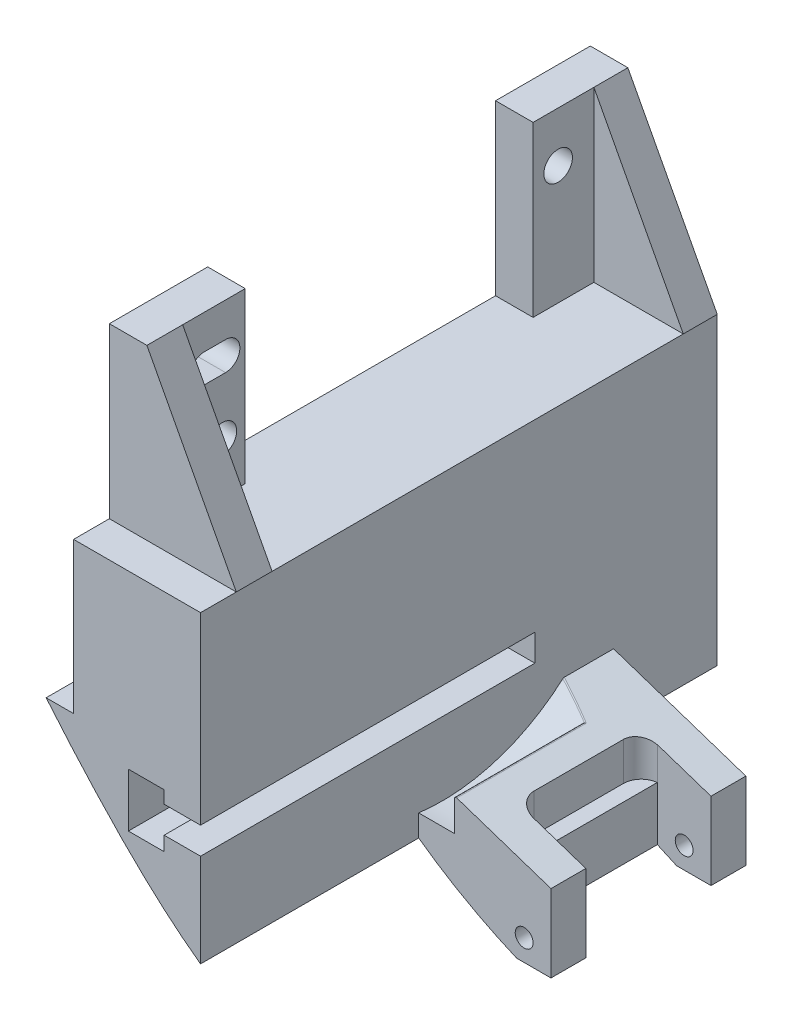
from build123d import *

# Parameters (mm, degrees)
BOSS_EXTRUDE1_DEPTH = 73.406
SKETCH2_W           = 5.08
SKETCH2_H           = 23.996252619
SKETCH2_W_2         = 40.894
CUT_EXTRUDE1_DEPTH  = 112.686247001
SKETCH3_W           = 58.42
SKETCH3_H           = 23.996252619
CUT_EXTRUDE2_DEPTH  = 12.7
SKETCH4_R           = 2.032
CUT_EXTRUDE3_DEPTH  = 114.950293405
SKETCH5_W           = 30.988
SKETCH5_H           = 17.263986836
SKETCH5_W_2         = 14.732
CUT_EXTRUDE4_DEPTH  = 18.796
CUT_EXTRUDE5_DEPTH  = 47.498
SKETCH7_W           = 7.62
SKETCH7_H           = 17.78
CUT_EXTRUDE6_DEPTH  = 22.098
CUT_EXTRUDE7_DEPTH  = 42.164
SKETCH9_R           = 1.27
CUT_EXTRUDE8_DEPTH  = 777.033475109
CUT_EXTRUDE9_DEPTH  = 5.08
FILLET1_R           = 0.254


with BuildPart() as part:
    # Sketch1 → Boss-Extrude1 (new body)
    with BuildSketch(Plane.XY):
        with BuildLine():
            Line((-748.665, -64.002429831), (-748.665, -30.220429831))
            Line((-748.665, -30.220429831), (-761.365, -6.224177212))
            Line((-761.365, -6.224177212), (-766.699, -6.224177212))
            Line((-766.699, -6.224177212), (-766.699, -51.658164167))
            Line((-766.699, -51.658164167), (-770.600050032, -51.658164167))
            add(Edge.make_bspline(
                [(-770.600050032, -51.658164167), (-769.474110637, -53.020450544), (-766.896191207, -56.054888677), (-762.734517182, -60.657959907), (-758.1103328, -65.445789554), (-753.453331209, -69.75760173), (-750.223005304, -72.311764833), (-748.665, -73.440199402)],
                knots=[0.071886948, 0.071886948, 0.071886948, 0.071886948, 0.078125, 0.0859375, 0.09375, 0.1015625, 0.108408754, 0.108408754, 0.108408754, 0.108408754], degree=3))
            Line((-748.665, -73.440199402), (-748.665, -64.002429831))
        make_face()
        with BuildLine():
            Line((-729.869, -70.265959359), (-748.665, -64.002429831))
            Line((-748.665, -64.002429831), (-748.665, -73.440199402))
            add(Edge.make_bspline(
                [(-748.665, -73.440199402), (-748.445110963, -73.599460985), (-744.652568783, -76.312065429), (-739.987854595, -78.967573397), (-735.357324532, -81.008335743), (-734.751026936, -81.266416667)],
                knots=[0.108408754, 0.108408754, 0.108408754, 0.108408754, 0.109375, 0.125, 0.127339677, 0.127339677, 0.127339677, 0.127339677], degree=3))
            Line((-734.751026936, -81.266416667), (-729.869, -81.266416667))
            Line((-729.869, -81.266416667), (-729.869, -70.265959359))
        make_face()
    extrude(amount=BOSS_EXTRUDE1_DEPTH)

    # Sketch2 → Cut-Extrude1 (cut, through all)
    with BuildSketch(Plane(origin=(-748.665, 0, 0), x_dir=(0, 0, -1), z_dir=(1, 0, 0))):
        with Locations((-70.866, -18.222303522)):
            Rectangle(SKETCH2_W, SKETCH2_H)
        with Locations((-33.909, -18.222303522)):
            Rectangle(SKETCH2_W_2, SKETCH2_H)
    extrude(amount=-CUT_EXTRUDE1_DEPTH, mode=Mode.SUBTRACT)

    # Sketch3 → Cut-Extrude2 (cut)
    with BuildSketch(Plane(origin=(-748.665, 0, 0), x_dir=(0, 0, -1), z_dir=(1, 0, 0))):
        with Locations((-34.036, -18.222303522)):
            Rectangle(SKETCH3_W, SKETCH3_H)
    extrude(amount=-CUT_EXTRUDE2_DEPTH, mode=Mode.SUBTRACT)

    # Sketch4 → Cut-Extrude3 (cut, through all)
    with BuildSketch(Plane(origin=(-761.365, 0, 0), x_dir=(0, 0, -1), z_dir=(1, 0, 0))):
        with Locations((-57.610523574, -23.108429831)):
            Circle(SKETCH4_R)
        with Locations((-9.906, -13.336177212)):
            Circle(SKETCH4_R)
        with BuildLine():
            Line((-60.198, -11.101802223), (-57.15, -11.101802223))
            ThreePointArc((-57.15, -11.101802223), (-55.118, -13.133802223), (-57.15, -15.165802223))
            Line((-57.15, -15.165802223), (-60.198, -15.165802223))
            ThreePointArc((-60.198, -15.165802223), (-62.23, -13.133802223), (-60.198, -11.101802223))
        make_face()
        with BuildLine():
            Line((-10.668, -31.774706288), (-7.62, -31.774706288))
            ThreePointArc((-7.62, -31.774706288), (-5.588, -33.806706288), (-7.62, -35.838706288))
            Line((-7.62, -35.838706288), (-10.668, -35.838706288))
            ThreePointArc((-10.668, -35.838706288), (-12.7, -33.806706288), (-10.668, -31.774706288))
        make_face()
    extrude(amount=-CUT_EXTRUDE3_DEPTH, mode=Mode.SUBTRACT)

    # Sketch5 → Cut-Extrude4 (cut)
    with BuildSketch(Plane(origin=(-729.869, 0, 0), x_dir=(0, 0, -1), z_dir=(1, 0, 0))):
        with Locations((-57.912, -72.634423249)):
            Rectangle(SKETCH5_W, SKETCH5_H)
        with Locations((-7.366, -72.634423249)):
            Rectangle(SKETCH5_W_2, SKETCH5_H)
    extrude(amount=-CUT_EXTRUDE4_DEPTH, mode=Mode.SUBTRACT)

    # Sketch6 → Cut-Extrude5 (cut)
    with BuildSketch(Plane.XY.offset(73.406)):
        Polygon((-748.665, -56.374416667), (-748.665, -60.184416667), (-753.836367364, -60.184416667), (-753.836367364, -62.216416667), (-758.916367364, -62.216416667), (-758.916367364, -54.596416667), (-753.836367364, -54.596416667), (-753.836367364, -56.374416667), align=None)
    extrude(amount=-CUT_EXTRUDE5_DEPTH, mode=Mode.SUBTRACT)

    # Sketch7 → Cut-Extrude6 (cut)
    with BuildSketch(Plane.XZ.offset(81.266416667)):
        with Locations((-733.679, 28.575)):
            Rectangle(SKETCH7_W, SKETCH7_H)
    extrude(amount=-CUT_EXTRUDE6_DEPTH, mode=Mode.SUBTRACT)

    # Sketch8 → Cut-Extrude7 (cut)
    with BuildSketch(Plane(origin=(0, -30.220429831, 0), x_dir=(1, 0, 0), z_dir=(0, 1, 0))):
        with BuildLine():
            Line((-729.869, -37.465), (-737.235, -37.465))
            ThreePointArc((-737.235, -37.465), (-739.031051224, -36.721051224), (-739.775, -34.925))
            Line((-739.775, -34.925), (-739.775, -22.225))
            ThreePointArc((-739.775, -22.225), (-739.031051224, -20.428948776), (-737.235, -19.685))
            Line((-737.235, -19.685), (-729.869, -19.685))
            Line((-729.869, -19.685), (-729.869, -37.465))
        make_face()
    extrude(amount=-CUT_EXTRUDE7_DEPTH, mode=Mode.SUBTRACT)

    # Sketch9 → Cut-Extrude8 (cut, through all)
    with BuildSketch(Plane.XY.offset(42.418)):
        with Locations((-733.679, -78.218416667)):
            Circle(SKETCH9_R)
    extrude(amount=-CUT_EXTRUDE8_DEPTH, mode=Mode.SUBTRACT)

    # Sketch12 → Cut-Extrude9 (cut)
    with BuildSketch(Plane(origin=(-748.665, 0, 0), x_dir=(0, 0, -1), z_dir=(1, 0, 0))):
        with BuildLine():
            Line((-42.418, -64.002429831), (-21.844, -64.002429831))
            ThreePointArc((-21.844, -64.002429831), (-31.440091509, -69.415973341), (-42.418, -70.352429831))
            Line((-42.418, -70.352429831), (-42.418, -64.002429831))
        make_face()
    extrude(amount=CUT_EXTRUDE9_DEPTH, mode=Mode.SUBTRACT)

    # Fillet1
    fillet1_edges = [part.edges().sort_by_distance(p)[0] for p in [
        (-743.585, -65.69527565, 33.18708051),
        (-746.106672699, -64.854960082, 22.851173008),
    ]]
    fillet(fillet1_edges, radius=FILLET1_R)


solid = part.part
